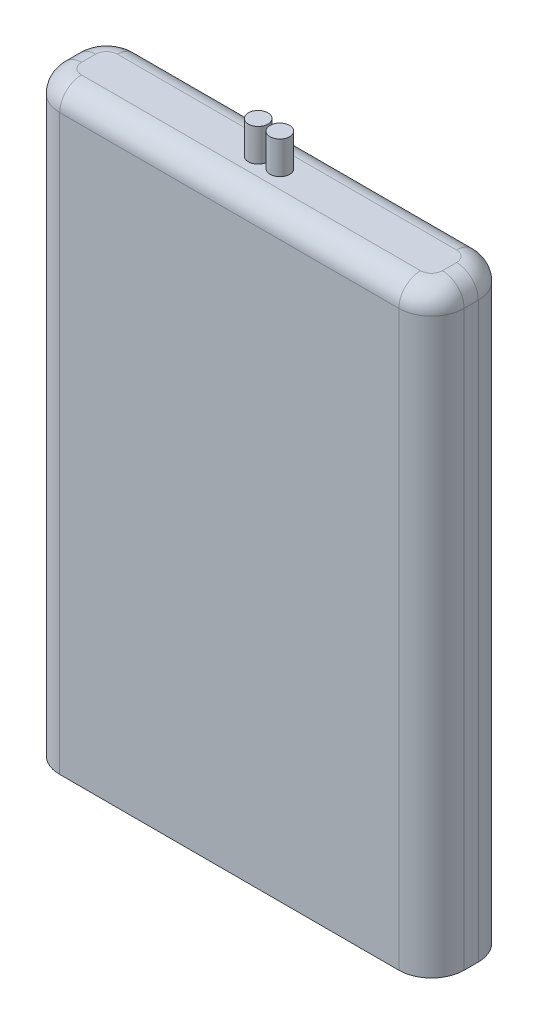
from build123d import *

# Parameters (mm, degrees)
SKETCH1_W           = 37.16
SKETCH1_H           = 54.67
BOSS_EXTRUDE1_DEPTH = 3.65
FILLET1_R           = 3
FILLET2_R           = 2
SKETCH2_R           = 0.900344027
BOSS_EXTRUDE2_DEPTH = 3


with BuildPart() as part:
    # Sketch1 → Boss-Extrude1 (new, symmetric)
    with BuildSketch(Plane.XY):
        Rectangle(SKETCH1_W, SKETCH1_H)
    extrude(amount=BOSS_EXTRUDE1_DEPTH, both=True)

    # Fillet1
    fillet1_edges = [part.edges().sort_by_distance(p)[0] for p in [
        (-18.58, 0, 3.65),
        (18.58, 0, 3.65),
        (-18.58, 0, -3.65),
        (18.58, 0, -3.65),
    ]]
    fillet(fillet1_edges, radius=FILLET1_R)

    # Fillet2
    fillet2_edges = [part.edges().sort_by_distance(p)[0] for p in [
        (-18.58, 27.335, 0),
        (0, 27.335, -3.65),
        (0, 27.335, 3.65),
        (18.58, 27.335, 0),
        (17.701320344, 27.335, 2.771320344),
        (17.701320344, 27.335, -2.771320344),
        (-17.701320344, 27.335, 2.771320344),
        (-17.701320344, 27.335, -2.771320344),
    ]]
    fillet(fillet2_edges, radius=FILLET2_R)

    # Sketch2 → Boss-Extrude2 (add)
    with BuildSketch(Plane(origin=(0, 27.335, 0), x_dir=(1, 0, 0), z_dir=(0, 1, 0))):
        with Locations(Location((-1, 0, 0), (0, 0, 90))):
            Circle(SKETCH2_R)
        with Locations(Location((1, 0, 0), (0, 0, 90))):
            Circle(SKETCH2_R)
    extrude(amount=BOSS_EXTRUDE2_DEPTH)


solid = part.part
